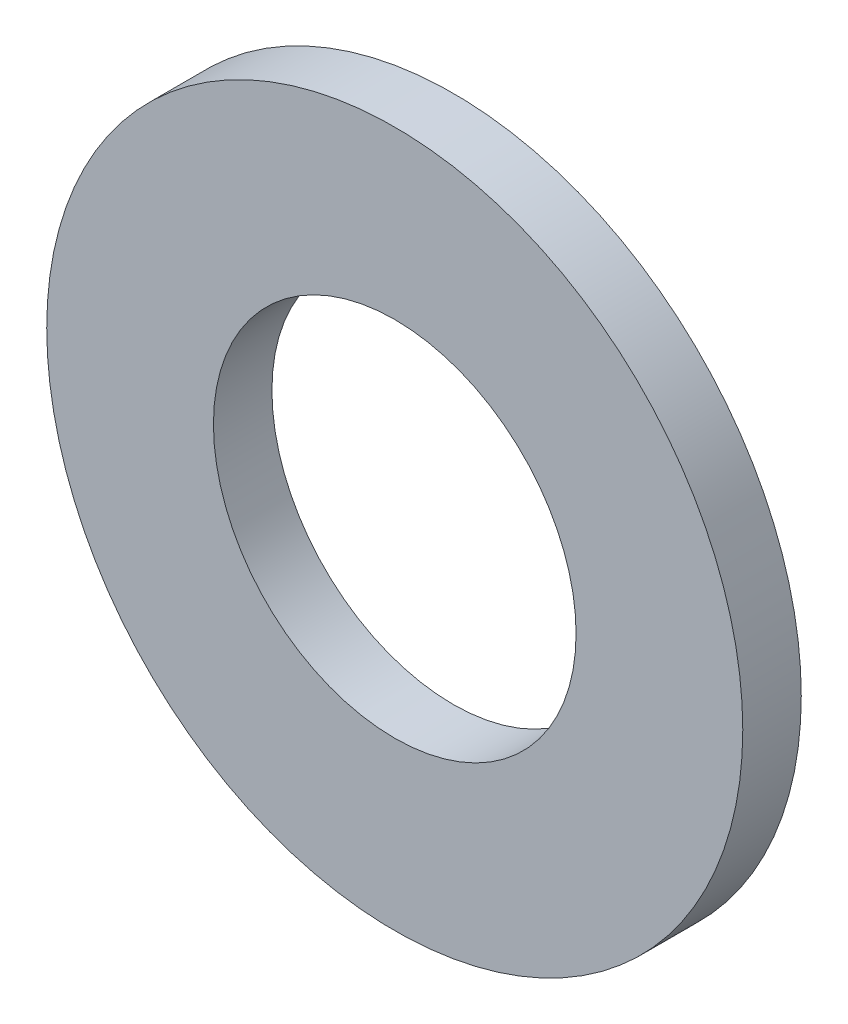
from build123d import *

# Parameters (mm, degrees)
ESQUISSE1_R        = 5.95
ESQUISSE1_R_2      = 3.1
BOSS_EXTRU_1_DEPTH = 1


with BuildPart() as part:
    # Esquisse1 → Boss.-Extru.1 (new body)
    with BuildSketch(Plane.XY):
        Circle(ESQUISSE1_R)
        Circle(ESQUISSE1_R_2, mode=Mode.SUBTRACT)
    extrude(amount=BOSS_EXTRU_1_DEPTH)


solid = part.part
